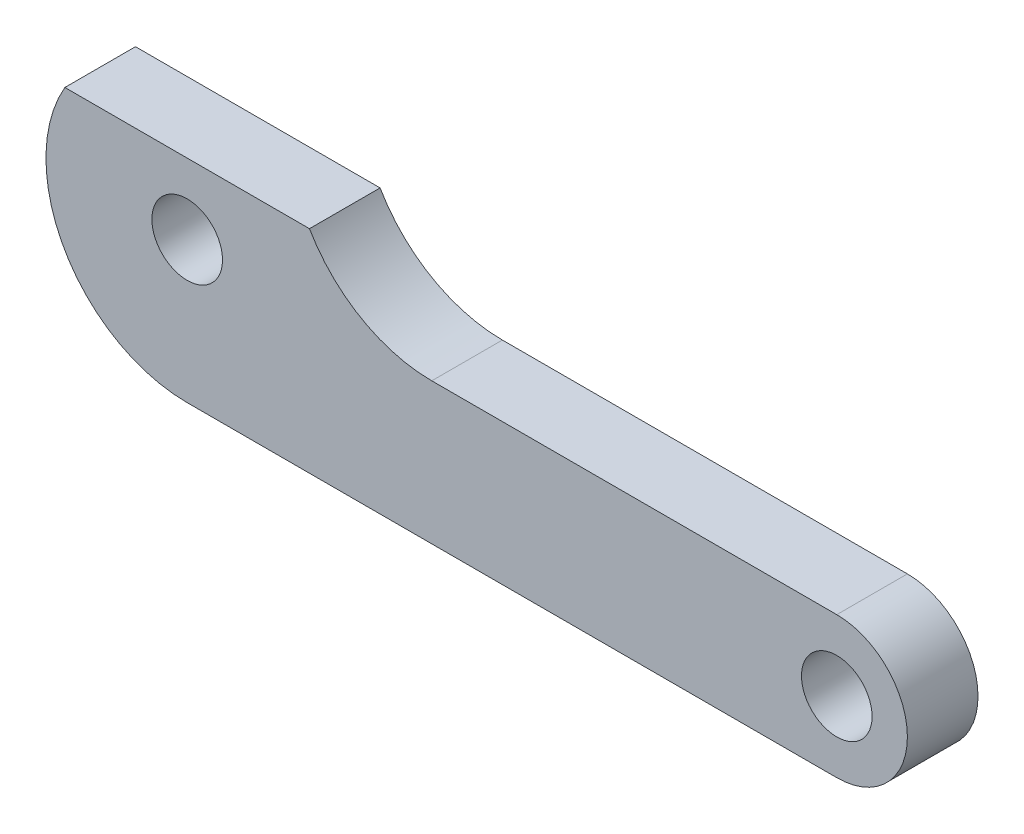
from build123d import *

# Parameters (mm, degrees)
ESQUISSE1_R             = 2.5
BOSS_EXTRU_1_DEPTH      = 5
CONG_1_R                = 10
ESQUISSE2_W             = 18.660254038
ESQUISSE2_H             = 5
ENL_V_MAT_EXTRU_1_DEPTH = 5


with BuildPart() as part:
    # Esquisse1 → Boss.-Extru.1 (new body)
    with BuildSketch(Plane.XY):
        with BuildLine():
            Line((0, 0), (-46, 0))
            ThreePointArc((-46, 0), (-53.071067812, 17.071067812), (-36, 10))
            Line((-36, 10), (0, 10))
            ThreePointArc((0, 10), (5, 5), (0, 0))
        make_face()
        with Locations((-46, 10)):
            Circle(ESQUISSE1_R, mode=Mode.SUBTRACT)
        with Locations((0, 5)):
            Circle(ESQUISSE1_R, mode=Mode.SUBTRACT)
    extrude(amount=BOSS_EXTRU_1_DEPTH)

    # Congé1
    cong_1_edges = [part.edges().sort_by_distance(p)[0] for p in [
        (-36, 10, 2.5),
    ]]
    fillet(cong_1_edges, radius=CONG_1_R)

    # Esquisse2 → Enlèv. mat.-Extru.1 (cut)
    with BuildSketch(Plane.XY.offset(5)):
        with Locations((-46.669872981, 17.5)):
            Rectangle(ESQUISSE2_W, ESQUISSE2_H)
    extrude(amount=-ENL_V_MAT_EXTRU_1_DEPTH, mode=Mode.SUBTRACT)


solid = part.part
